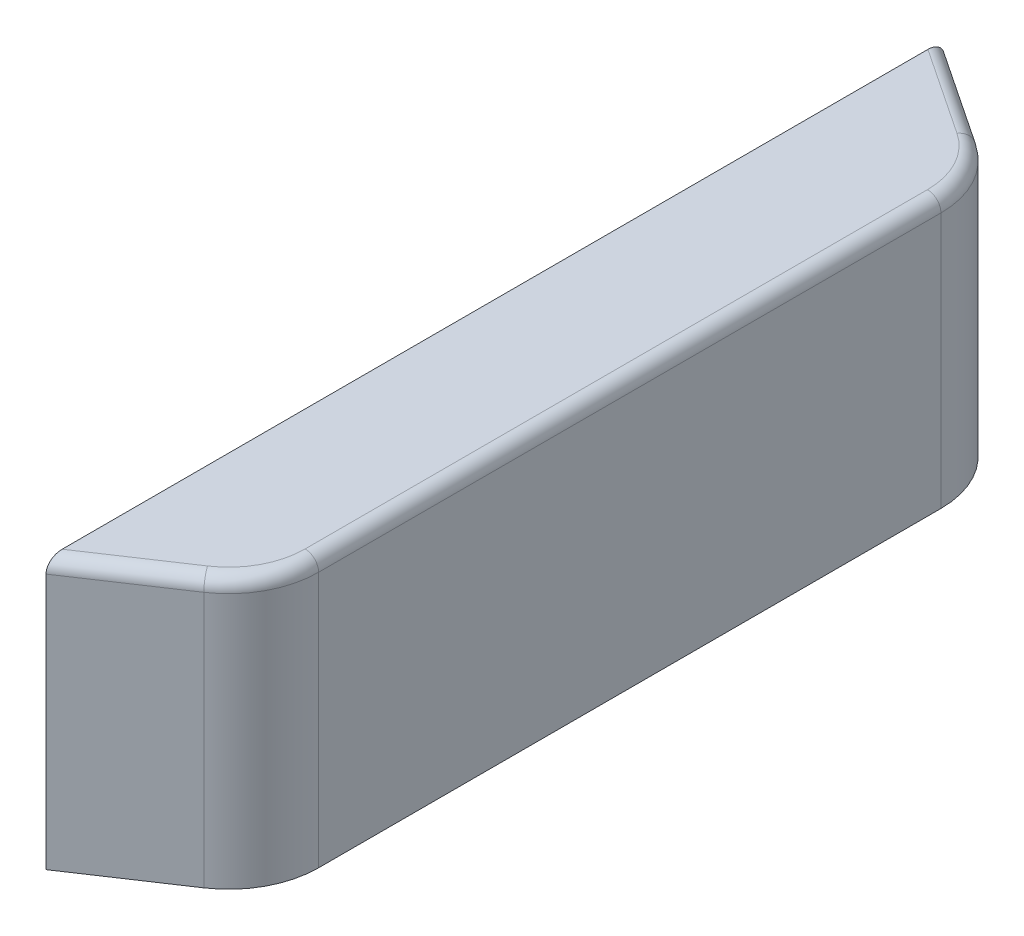
from build123d import *

# Parameters (mm, degrees)
BOSS_EXTRUDE1_DEPTH = 30
SHELL1_T            = -1.5
FILLET1_R           = 2
FILLET2_R           = 1.5


with BuildPart() as part:
    # Sketch1 → Boss-Extrude1 (new body)
    with BuildSketch(Plane(origin=(0, 0, 0), x_dir=(1, 0, 0), z_dir=(0, 1, 0))):
        with BuildLine():
            Line((0, -50), (0, 50))
            Line((0, 50), (10.547001962, 42.968665358))
            ThreePointArc((10.547001962, 42.968665358), (13.816745988, 39.36674167), (15, 34.648162415))
            Line((15, 34.648162415), (15, -34.648162415))
            ThreePointArc((15, -34.648162415), (13.816745988, -39.36674167), (10.547001962, -42.968665358))
            Line((10.547001962, -42.968665358), (0, -50))
        make_face()
    extrude(amount=BOSS_EXTRUDE1_DEPTH)

    # Shell1
    shell1_openings = [part.faces().sort_by_distance(p)[0] for p in [
        (7.177503817, 0, 0),
    ]]
    offset(amount=SHELL1_T, openings=shell1_openings, kind=Kind.INTERSECTION)

    # Fillet1
    fillet1_edges = [part.edges().sort_by_distance(p)[0] for p in [
        (1.5, 14.25, -47.197224362),
        (1.5, 14.25, 47.197224362),
        (5.607475834, 28.5, -44.45890714),
        (1.5, 28.5, 0),
        (5.607475834, 28.5, 44.45890714),
        (12.49423409, 28.5, 38.658954782),
        (13.5, 28.5, 0),
        (12.49423409, 28.5, -38.658954782),
    ]]
    fillet(fillet1_edges, radius=FILLET1_R)

    # Fillet2
    fillet2_edges = [part.edges().sort_by_distance(p)[0] for p in [
        (5.273500981, 30, 46.484332679),
        (13.816745988, 30, 39.36674167),
        (15, 30, 0),
        (13.816745988, 30, -39.36674167),
        (5.273500981, 30, -46.484332679),
    ]]
    fillet(fillet2_edges, radius=FILLET2_R)


solid = part.part
